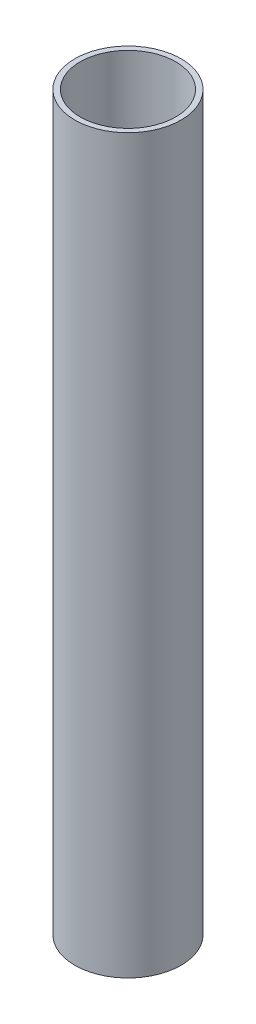
from build123d import *

# Parameters (mm, degrees)
SKETCH1_R           = 10
SKETCH1_R_2         = 9
BOSS_EXTRUDE1_DEPTH = 137.8


with BuildPart() as part:
    # Sketch1 → Boss-Extrude1 (new body)
    with BuildSketch(Plane(origin=(0, 0, 0), x_dir=(1, 0, 0), z_dir=(0, 1, 0))):
        with Locations(Location((0, 0, 0), (0, 0, 270))):
            Circle(SKETCH1_R)
        with Locations(Location((0, 0, 0), (0, 0, 270))):
            Circle(SKETCH1_R_2, mode=Mode.SUBTRACT)
    extrude(amount=BOSS_EXTRUDE1_DEPTH)


solid = part.part
